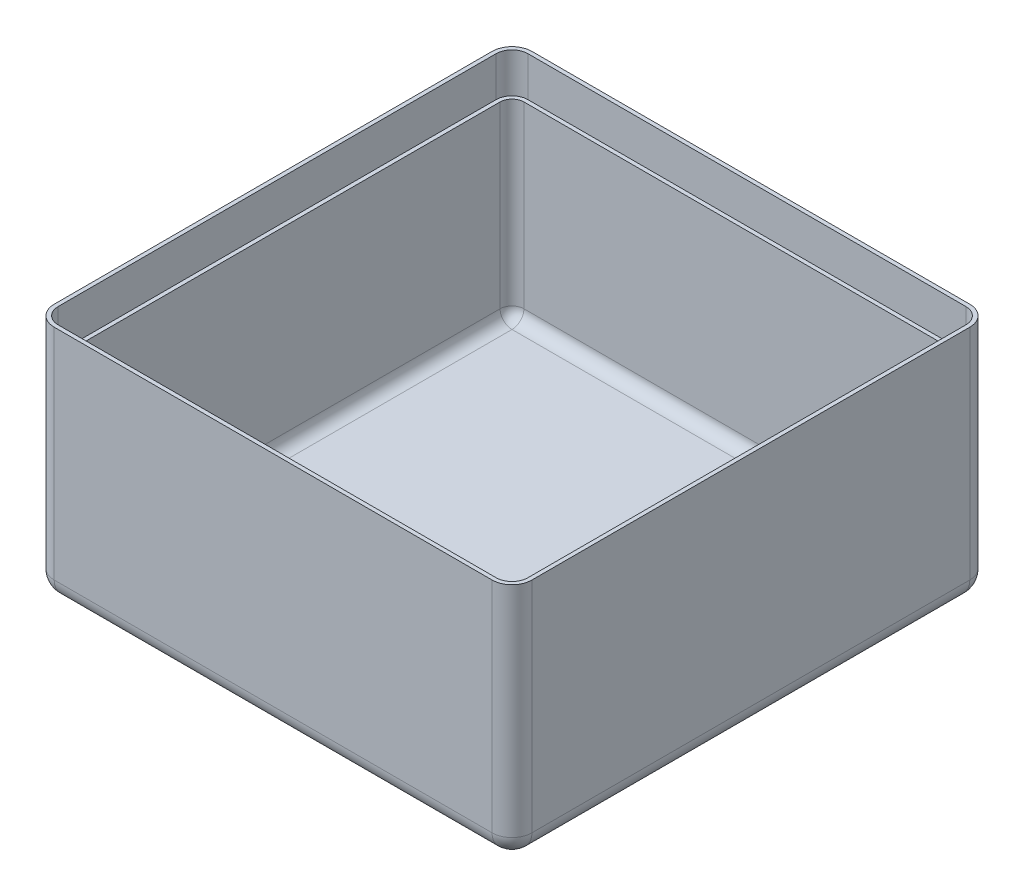
from build123d import *

# Parameters (mm, degrees)
SKETCH1_W           = 60
SKETCH1_H           = 60
BOSS_EXTRUDE1_DEPTH = 25
FILLET1_R           = 2.5
SHELL1_T            = -1
BOSS_EXTRUDE2_START = 5
BOSS_EXTRUDE2_DEPTH = 5


with BuildPart() as part:
    # Sketch1 → Boss-Extrude1 (new body)
    with BuildSketch(Plane(origin=(0, 0, 0), x_dir=(1, 0, 0), z_dir=(0, 1, 0))):
        with Locations((30, 30)):
            Rectangle(SKETCH1_W, SKETCH1_H)
    extrude(amount=BOSS_EXTRUDE1_DEPTH)

    # Fillet1
    fillet1_edges = [part.edges().sort_by_distance(p)[0] for p in [
        (30, 0, -60),
        (60, 0, -30),
        (30, 0, 0),
        (0, 0, -30),
        (0, 12.5, -60),
        (60, 12.5, -60),
        (60, 12.5, 0),
        (0, 12.5, 0),
    ]]
    fillet(fillet1_edges, radius=FILLET1_R)

    # Shell1
    shell1_openings = [part.faces().sort_by_distance(p)[0] for p in [
        (30, 25, -30),
    ]]
    offset(amount=SHELL1_T, openings=shell1_openings, kind=Kind.INTERSECTION)

    # Sketch2 → Boss-Extrude2 (add)
    with BuildSketch(Plane(origin=(0, 25, 0), x_dir=(1, 0, 0), z_dir=(0, 1, 0)).offset(BOSS_EXTRUDE2_START)):
        with BuildLine():
            Line((57.5, 60), (2.5, 60))
            ThreePointArc((2.5, 60), (0.732233047, 59.267766953), (0, 57.5))
            Line((0, 57.5), (0, 2.5))
            ThreePointArc((0, 2.5), (0.732233047, 0.732233047), (2.5, 0))
            Line((2.5, 0), (57.5, 0))
            ThreePointArc((57.5, 0), (59.267766953, 0.732233047), (60, 2.5))
            Line((60, 2.5), (60, 57.5))
            ThreePointArc((60, 57.5), (59.267766953, 59.267766953), (57.5, 60))
        make_face()
        with BuildLine():
            Line((57.5, 59.5), (2.5, 59.5))
            ThreePointArc((2.5, 59.5), (1.085786438, 58.914213562), (0.5, 57.5))
            Line((0.5, 57.5), (0.5, 2.5))
            ThreePointArc((0.5, 2.5), (1.085786438, 1.085786438), (2.5, 0.5))
            Line((2.5, 0.5), (57.5, 0.5))
            ThreePointArc((57.5, 0.5), (58.914213562, 1.085786438), (59.5, 2.5))
            Line((59.5, 2.5), (59.5, 57.5))
            ThreePointArc((59.5, 57.5), (58.914213562, 58.914213562), (57.5, 59.5))
        make_face(mode=Mode.SUBTRACT)
    extrude(amount=-BOSS_EXTRUDE2_DEPTH)


solid = part.part
